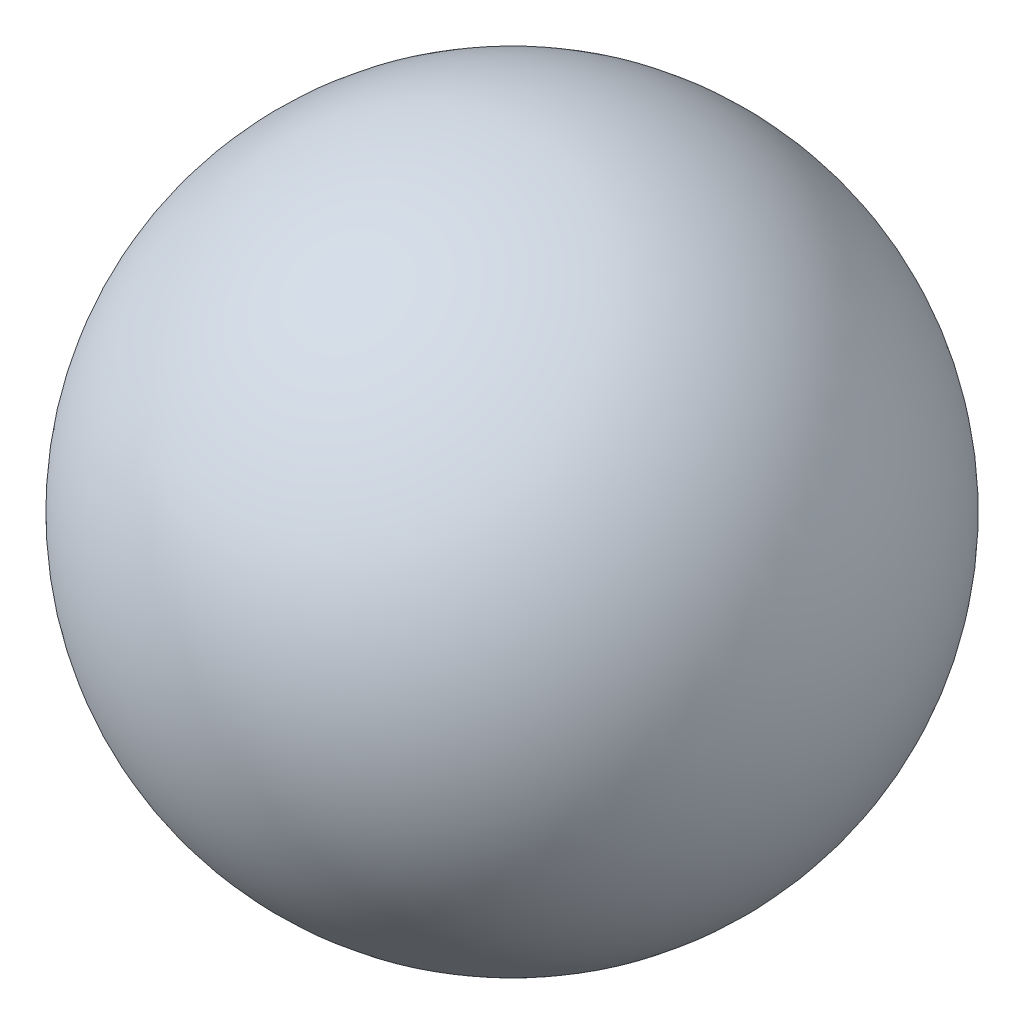
from build123d import *


with BuildPart() as part:
    # Sketch1 → Revolve1 (revolve)
    with BuildSketch(Plane.XY):
        with BuildLine():
            Line((0, 12), (0, -12))
            ThreePointArc((0, -12), (12, 0), (0, 12))
        make_face()
    revolve(axis=Axis((0, 12, 0), (0, -1, 0)))


solid = part.part
